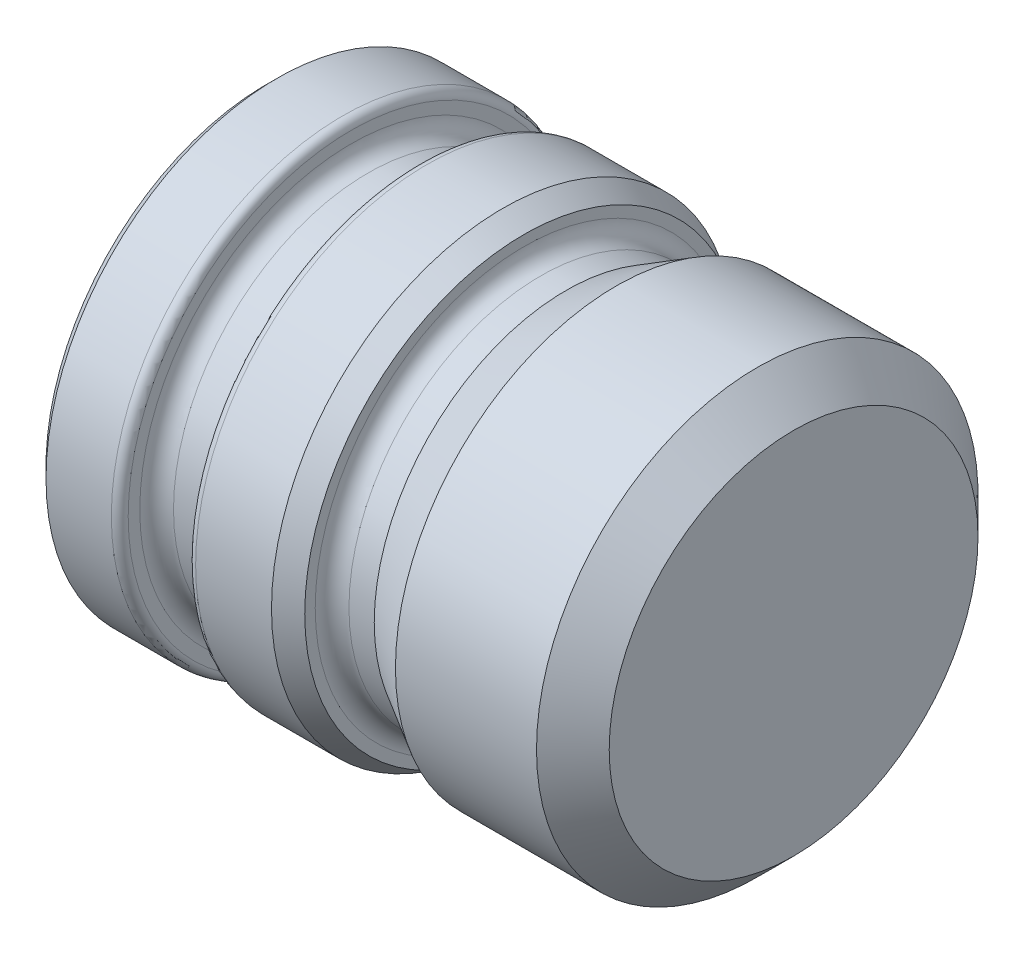
from build123d import *

# Parameters (mm, degrees)
SKETCH2_W          = 10
SKETCH2_H          = 10
CUT_EXTRUDE1_DEPTH = 10
CHAMFER2_SIZE      = 0.5
CHAMFER3_SIZE      = 1
CHAMFER3_SIZE2     = 0.577350269
SKETCH3_R          = 1.75
CUT_EXTRUDE2_DEPTH = 10
CHAMFER4_SIZE      = 0.5
CUT_EXTRUDE3_DEPTH = 0.01


with BuildPart() as part:
    # Sketch1 → Revolve1 (revolve)
    with BuildSketch(Plane.XY, mode=Mode.PRIVATE) as revolve1_sk:
        with BuildLine():
            Line((0, 0), (0, 8.75))
            Line((0, 8.75), (-1.725, 10.475))
            Line((-1.725, 10.475), (-8.41843014, 10.475))
            Line((-8.41843014, 10.475), (-10.8, 9.1))
            Line((-10.8, 9.1), (-12, 9.1))
            ThreePointArc((-12, 9.1), (-12.565685425, 9.334314575), (-12.8, 9.9))
            Line((-12.8, 9.9), (-12.8, 10.975))
            Line((-12.8, 10.975), (-17.4, 10.975))
            ThreePointArc((-17.4, 10.975), (-17.682842712, 10.857842712), (-17.8, 10.575))
            Line((-17.8, 10.575), (-17.8, 10.025))
            ThreePointArc((-17.8, 10.025), (-18.034314575, 9.459314575), (-18.6, 9.225))
            Line((-18.6, 9.225), (-20.2, 9.225))
            ThreePointArc((-20.2, 9.225), (-20.765685425, 9.459314575), (-21, 10.025))
            Line((-21, 10.025), (-21, 10.575))
            ThreePointArc((-21, 10.575), (-21.117157288, 10.857842712), (-21.4, 10.975))
            Line((-21.4, 10.975), (-25, 10.975))
            Line((-25, 10.975), (-25, 0))
            Line((-25, 0), (0, 0))
        make_face()
    revolve(revolve1_sk.sketch.rotate(Axis((0, 0, 0), (1, 0, 0)), 90), axis=Axis((0, 0, 0), (1, 0, 0)))

    # Sketch2 → Cut-Extrude1 (cut)
    with BuildSketch(Plane.ZY.offset(25)):
        Rectangle(SKETCH2_W, SKETCH2_H)
    extrude(amount=-CUT_EXTRUDE1_DEPTH, mode=Mode.SUBTRACT)

    # Chamfer2
    chamfer2_edges = [part.edges().sort_by_distance(p)[0] for p in [
        (-25, 0, -10.975),
    ]]
    chamfer(chamfer2_edges, length=CHAMFER2_SIZE)

    # Chamfer3
    chamfer3_edges = [part.edges().sort_by_distance(p)[0] for p in [
        (-12.8, 0, -10.975),
    ]]
    chamfer3_side = [part.faces().sort_by_distance(p)[0] for p in [
        (-15.1, 0, -10.975),
    ]]
    chamfer(chamfer3_edges, length=CHAMFER3_SIZE, length2=CHAMFER3_SIZE2, reference=chamfer3_side[0])

    # Sketch3 → Cut-Extrude2 (cut)
    with BuildSketch(Plane.ZY.offset(25)):
        with Locations((3.8, 3.8)):
            Circle(SKETCH3_R)
        with Locations((-3.8, 3.8)):
            Circle(SKETCH3_R)
        with Locations((3.8, -3.8)):
            Circle(SKETCH3_R)
        with Locations((-3.8, -3.8)):
            Circle(SKETCH3_R)
    extrude(amount=-CUT_EXTRUDE2_DEPTH, mode=Mode.SUBTRACT)

    # Chamfer4
    chamfer4_edges = [part.edges().sort_by_distance(p)[0] for p in [
        (-25, 5, 0),
        (-25, 5.037436867, 5.037436867),
        (-25, 0, -5),
        (-25, 5.037436867, -5.037436867),
        (-25, 0, 5),
        (-25, -5.037436867, 5.037436867),
        (-25, -5, 0),
        (-25, -5.037436867, -5.037436867),
    ]]
    chamfer(chamfer4_edges, length=CHAMFER4_SIZE)

    # Sketch4 → Cut-Extrude3 (cut)
    # profile 1 of 9: a face of its own
    with BuildSketch(Plane.ZY.offset(25)):
        Polygon((-4.989709676, -6.578354422), (-4.712365926, -6.578354422), (-4.712365926, -8.078354422), (-4.84698131, -8.078354422), (-4.84698131, -6.732200576), (-5.077750541, -6.732200576), align=None)
    # profile 2 of 9: a face of its own
    with BuildSketch(Plane.ZY.offset(25)):
        with BuildLine():
            Line((-3.212365926, -6.578354422), (-3.212365926, -6.732200576))
            Line((-3.212365926, -6.732200576), (-3.722582272, -6.732200576))
            Line((-3.722582272, -6.732200576), (-3.803411599, -7.126731826))
            add(Edge.make_bspline(
                [(-3.803411599, -7.126731826), (-3.78753051, -7.122347424), (-3.756763411, -7.113853338), (-3.711352042, -7.104422293), (-3.668241098, -7.098737103), (-3.640265939, -7.097960827), (-3.626728906, -7.097585191)],
                knots=[0, 0, 0, 0, 1.100273476, 2.13160584, 3.095893838, 4, 4, 4, 4], degree=3))
            add(Edge.make_bspline(
                [(-3.626728906, -7.097585191), (-3.609978732, -7.097947735), (-3.577043705, -7.098660587), (-3.528855585, -7.105505665), (-3.482855773, -7.116279914), (-3.439140472, -7.131331567), (-3.397628807, -7.150578595), (-3.358702709, -7.174621427), (-3.321777889, -7.20270714), (-3.287516778, -7.234997859), (-3.256434931, -7.270535695), (-3.22910665, -7.308746211), (-3.205894111, -7.349258066), (-3.187225217, -7.392458327), (-3.172317645, -7.437869393), (-3.162395361, -7.485969071), (-3.1557882, -7.53630398), (-3.155050035, -7.570720224), (-3.154673618, -7.588270287)],
                knots=[0, 0, 0, 0, 1.052922333, 2.070308379, 3.05430497, 4.020497103, 4.973039431, 5.925935799, 6.892292201, 7.88610001, 8.88166317, 9.857072816, 10.836096531, 11.812156883, 12.81219415, 13.836441305, 14.89672472, 16, 16, 16, 16], degree=3))
            add(Edge.make_bspline(
                [(-3.154673618, -7.588270287), (-3.15495865, -7.600494096), (-3.155524863, -7.624776519), (-3.158404257, -7.66083832), (-3.163948136, -7.696136677), (-3.171391446, -7.730676273), (-3.181052482, -7.764391718), (-3.192747791, -7.797379516), (-3.207060374, -7.829434347), (-3.222759535, -7.860859517), (-3.240436597, -7.890944591), (-3.260055957, -7.919079871), (-3.280784025, -7.94568742), (-3.303087476, -7.970481877), (-3.327173617, -7.993300314), (-3.352750745, -8.014278149), (-3.379614768, -8.033770147), (-3.4081813, -8.050985088), (-3.437813793, -8.066826355), (-3.468940172, -8.079822157), (-3.500851901, -8.091440955), (-3.534008276, -8.100702181), (-3.568334195, -8.10795899), (-3.603886242, -8.112887819), (-3.640477958, -8.11647772), (-3.665281535, -8.116702445), (-3.677810637, -8.11681596)],
                knots=[0, 0, 0, 0, 1.056347294, 2.098418968, 3.122841568, 4.141288669, 5.149314143, 6.15115421, 7.162517403, 8.180376062, 9.185164535, 10.17417709, 11.141909838, 12.097768115, 13.052685741, 14.0056014, 14.954263652, 15.917497458, 16.885230207, 17.854509472, 18.828990115, 19.81800267, 20.826176721, 21.857883937, 22.917946725, 24, 24, 24, 24], degree=3))
            add(Edge.make_bspline(
                [(-3.677810637, -8.11681596), (-3.692756715, -8.116519887), (-3.722161356, -8.115937398), (-3.765241599, -8.109843761), (-3.806690716, -8.101116368), (-3.846175045, -8.087986538), (-3.884048444, -8.071534841), (-3.919801037, -8.050742196), (-3.95434637, -8.027179723), (-3.9862801, -7.999373857), (-4.015918434, -7.968981422), (-4.042449795, -7.935999576), (-4.066078471, -7.900972672), (-4.086426077, -7.863730606), (-4.103782371, -7.824371235), (-4.117417366, -7.782747092), (-4.128422376, -7.739075662), (-4.133078127, -7.709009872), (-4.135442849, -7.693739037)],
                knots=[0, 0, 0, 0, 1.0467383, 2.05933395, 3.04377827, 4.011590433, 4.970194871, 5.932262533, 6.905835911, 7.896367577, 8.894135286, 9.877477877, 10.858688626, 11.851381753, 12.8477658, 13.868841284, 14.917554742, 16, 16, 16, 16], degree=3))
            Line((-4.135442849, -7.693739037), (-4.000827464, -7.693739037))
            add(Edge.make_bspline(
                [(-4.000827464, -7.693739037), (-3.997515225, -7.708043231), (-3.991148918, -7.735536686), (-3.977175026, -7.774164404), (-3.960089651, -7.808586928), (-3.939773501, -7.839259607), (-3.915537774, -7.86600632), (-3.887882304, -7.889842204), (-3.856876137, -7.911345831), (-3.822421896, -7.929269874), (-3.786073433, -7.944556482), (-3.748030343, -7.95473578), (-3.709328481, -7.961893306), (-3.683152036, -7.962609774), (-3.669998137, -7.962969807)],
                knots=[0, 0, 0, 0, 1.136247022, 2.183929868, 3.172523383, 4.106158343, 5.02341133, 5.958108904, 6.928429099, 7.938127109, 8.96079061, 9.975095812, 10.982467395, 12, 12, 12, 12], degree=3))
            add(Edge.make_bspline(
                [(-3.669998137, -7.962969807), (-3.657158804, -7.962618045), (-3.631878051, -7.961925422), (-3.594673171, -7.956594417), (-3.558753368, -7.94838403), (-3.524473072, -7.936096949), (-3.491232413, -7.921163498), (-3.459872225, -7.901999894), (-3.429485278, -7.879945601), (-3.401016078, -7.854678473), (-3.374942028, -7.826834319), (-3.35190369, -7.797058293), (-3.332713585, -7.76529393), (-3.316541824, -7.73209115), (-3.304261839, -7.697086054), (-3.295501418, -7.660442693), (-3.29035725, -7.622070559), (-3.289649601, -7.595897998), (-3.289289002, -7.582561153)],
                knots=[0, 0, 0, 0, 1.027316725, 2.022795036, 3.002884548, 3.971462791, 4.93288096, 5.914575861, 6.907176829, 7.935150275, 8.956128384, 9.956726525, 10.942570165, 11.921478529, 12.907843606, 13.90538589, 14.932640048, 16, 16, 16, 16], degree=3))
            add(Edge.make_bspline(
                [(-3.289289002, -7.582561153), (-3.289571208, -7.570528688), (-3.290123585, -7.54697685), (-3.294636687, -7.512520047), (-3.302486818, -7.479917314), (-3.313382766, -7.449011214), (-3.327216841, -7.419772596), (-3.344122403, -7.392171284), (-3.364416717, -7.36657107), (-3.387598955, -7.342959976), (-3.412995258, -7.321169315), (-3.441042576, -7.302593278), (-3.471153973, -7.286965885), (-3.502966659, -7.2734796), (-3.53723733, -7.263793566), (-3.573287315, -7.256521615), (-3.611505904, -7.252315031), (-3.637636199, -7.251731365), (-3.651067849, -7.251431345)],
                knots=[0, 0, 0, 0, 1.045622112, 2.046656509, 3.013763289, 3.955457236, 4.890082067, 5.820317437, 6.762574623, 7.722996705, 8.69280354, 9.665887285, 10.63943826, 11.638615906, 12.663482002, 13.728887084, 14.832589034, 16, 16, 16, 16], degree=3))
            add(Edge.make_bspline(
                [(-3.651067849, -7.251431345), (-3.662694532, -7.25168017), (-3.686700685, -7.25219393), (-3.723524753, -7.255976714), (-3.762221206, -7.262079269), (-3.802641704, -7.270473375), (-3.844907636, -7.281458122), (-3.888929808, -7.29462148), (-3.934800779, -7.310359479), (-3.965708375, -7.322244714), (-3.981596695, -7.328354422)],
                knots=[0, 0, 0, 0, 0.817624296, 1.688186739, 2.600797293, 3.572016777, 4.590301741, 5.671205678, 6.80286297, 8, 8, 8, 8], degree=3))
            Line((-3.981596695, -7.328354422), (-3.827750541, -6.578354422))
            Line((-3.827750541, -6.578354422), (-3.212365926, -6.578354422))
        make_face()
    # profile 3 of 9: a face of its own
    with BuildSketch(Plane.ZY.offset(25)):
        with BuildLine():
            add(Edge.make_bspline(
                [(-3.000827464, -7.328955383), (-3.000686885, -7.304913646), (-3.000413808, -7.258212224), (-2.997375913, -7.190161663), (-2.992329338, -7.126321539), (-2.985413321, -7.066688797), (-2.976997043, -7.011248041), (-2.965761835, -6.96014743), (-2.95298492, -6.913150456), (-2.938176728, -6.870103864), (-2.921467676, -6.830427705), (-2.903281564, -6.793388333), (-2.882896652, -6.759041791), (-2.861477975, -6.726839881), (-2.838158516, -6.697309726), (-2.813601892, -6.670034299), (-2.786849659, -6.645643977), (-2.758811227, -6.623424134), (-2.729232742, -6.603945789), (-2.698957314, -6.586788901), (-2.667776554, -6.572131815), (-2.635605333, -6.560607342), (-2.602732808, -6.551088408), (-2.569044065, -6.544578859), (-2.534483481, -6.540483041), (-2.511155723, -6.540091469), (-2.49932506, -6.539892883)],
                knots=[0, 0, 0, 0, 1.646270934, 3.197905019, 4.663502075, 6.030701355, 7.308322542, 8.50163776, 9.611534131, 10.641858119, 11.616356847, 12.558055219, 13.465016945, 14.349605745, 15.204443733, 16.039544428, 16.859896111, 17.680448484, 18.487036065, 19.28249412, 20.06191084, 20.843045899, 21.620316918, 22.403196591, 23.190181807, 24, 24, 24, 24], degree=3))
            add(Edge.make_bspline(
                [(-2.49932506, -6.539892883), (-2.487395569, -6.540101947), (-2.463671566, -6.540517709), (-2.428597119, -6.544513684), (-2.39433297, -6.551144166), (-2.361025196, -6.560538869), (-2.328400202, -6.572194159), (-2.29671317, -6.586802924), (-2.265767278, -6.603808152), (-2.236054297, -6.623789814), (-2.207248034, -6.646067932), (-2.18005605, -6.671251933), (-2.15447587, -6.699087527), (-2.130186453, -6.729276898), (-2.107876912, -6.762399077), (-2.086631155, -6.797877981), (-2.067614568, -6.836334066), (-2.049299707, -6.877125695), (-2.033490999, -6.921381549), (-2.019234037, -6.96885216), (-2.007714479, -7.02009824), (-1.998119076, -7.074850917), (-1.990685549, -7.133311267), (-1.98527156, -7.195353974), (-1.982411666, -7.261019855), (-1.98187308, -7.305916076), (-1.981596695, -7.328955383)],
                knots=[0, 0, 0, 0, 0.810914788, 1.612654377, 2.396697861, 3.181598691, 3.963628158, 4.749916497, 5.551656086, 6.361998678, 7.18212741, 8.025565596, 8.878627764, 9.750805457, 10.657531673, 11.591944965, 12.560506719, 13.57287815, 14.630710178, 15.753379473, 16.941251878, 18.199788006, 19.531962791, 20.947069417, 22.433333509, 24, 24, 24, 24], degree=3))
            add(Edge.make_bspline(
                [(-1.981596695, -7.328955383), (-1.981875945, -7.351894201), (-1.982420054, -7.396589552), (-1.985239499, -7.46195997), (-1.990793198, -7.523673417), (-1.997740336, -7.581877901), (-2.007362177, -7.636331166), (-2.019192963, -7.687221644), (-2.032328816, -7.734769103), (-2.048543727, -7.778584023), (-2.066291175, -7.819277618), (-2.085600544, -7.857277825), (-2.106287613, -7.892920521), (-2.128825646, -7.925920413), (-2.152848538, -7.956511266), (-2.178870447, -7.984153104), (-2.206157841, -8.009511964), (-2.235048876, -8.032076947), (-2.265225255, -8.051827578), (-2.29606486, -8.069490656), (-2.328114881, -8.08373324), (-2.360649004, -8.095962543), (-2.394132589, -8.105305594), (-2.4285239, -8.111765818), (-2.463648001, -8.11629661), (-2.487391529, -8.116642244), (-2.49932506, -8.11681596)],
                knots=[0, 0, 0, 0, 1.561518951, 3.042555995, 4.452378317, 5.7783523, 7.031515105, 8.214008947, 9.334062868, 10.386615937, 11.391082383, 12.354592575, 13.286541444, 14.194233754, 15.072674879, 15.931287219, 16.775624067, 17.606195743, 18.42308326, 19.229000347, 20.022332153, 20.807536673, 21.593273796, 22.3848459, 23.188221202, 24, 24, 24, 24], degree=3))
            add(Edge.make_bspline(
                [(-2.49932506, -8.11681596), (-2.511155395, -8.116616094), (-2.534482505, -8.116221996), (-2.569047831, -8.112144682), (-2.602597449, -8.105589467), (-2.635296915, -8.096410922), (-2.667313993, -8.085175992), (-2.698212402, -8.070538699), (-2.728335695, -8.053681241), (-2.757603504, -8.034483203), (-2.785465859, -8.012488196), (-2.812079547, -7.988160644), (-2.836775984, -7.960893468), (-2.859762025, -7.931117215), (-2.881608063, -7.899105825), (-2.901703508, -7.864422237), (-2.920291017, -7.827203975), (-2.937281085, -7.787210585), (-2.952344798, -7.743858473), (-2.965650958, -7.696651682), (-2.976157026, -7.645173553), (-2.985149721, -7.589837538), (-2.992403028, -7.530405854), (-2.997354882, -7.466846234), (-3.000415445, -7.399198288), (-3.000687618, -7.352796956), (-3.000827464, -7.328955383)],
                knots=[0, 0, 0, 0, 0.810891512, 1.598919785, 2.382837074, 3.152667961, 3.926044502, 4.706494248, 5.493654104, 6.291793342, 7.103789334, 7.925228297, 8.761435821, 9.622817696, 10.50288917, 11.416980706, 12.369136599, 13.353924996, 14.394355917, 15.514179734, 16.714354668, 17.994756427, 19.357759367, 20.818452758, 22.365282078, 24, 24, 24, 24], degree=3))
        make_face()
        with BuildLine():
            add(Edge.make_bspline(
                [(-2.866212079, -7.328354422), (-2.866160888, -7.348389579), (-2.866061535, -7.387273883), (-2.86346602, -7.443778138), (-2.859930207, -7.496479708), (-2.855369651, -7.545445509), (-2.848596959, -7.5905098), (-2.841008335, -7.631982521), (-2.83177344, -7.669644194), (-2.820847003, -7.703753256), (-2.808401676, -7.734888571), (-2.794813449, -7.763860521), (-2.780215996, -7.791011351), (-2.763879217, -7.816097183), (-2.746087047, -7.839199824), (-2.727241365, -7.860728181), (-2.706638829, -7.879926887), (-2.678137225, -7.902952682), (-2.640510164, -7.926746597), (-2.593101398, -7.94746635), (-2.544386347, -7.960487402), (-2.511321526, -7.962143298), (-2.494817849, -7.962969807)],
                knots=[0, 0, 0, 0, 1.459021318, 2.831673884, 4.118529203, 5.306027144, 6.411944654, 7.436330062, 8.375795394, 9.233974572, 10.042671642, 10.816086306, 11.563610507, 12.285937304, 12.993564865, 13.685989202, 14.367179055, 15.041617293, 16.353048772, 17.594441528, 18.799311195, 20, 20, 20, 20], degree=3))
            add(Edge.make_bspline(
                [(-2.494817849, -7.962969807), (-2.478207418, -7.962285043), (-2.445020851, -7.960916931), (-2.396534939, -7.947717472), (-2.349464823, -7.927801955), (-2.312576848, -7.904253024), (-2.284512901, -7.881826597), (-2.26440562, -7.862706034), (-2.245950456, -7.841296376), (-2.22844671, -7.818196678), (-2.21239282, -7.792965613), (-2.197794333, -7.76572451), (-2.184472898, -7.736397719), (-2.176883307, -7.715924974), (-2.173002945, -7.705457787)],
                knots=[0, 0, 0, 0, 1.353760809, 2.704726607, 4.075137775, 5.516104923, 6.260822281, 7.007110065, 7.778089737, 8.566572457, 9.372053459, 10.217411131, 11.088608312, 12, 12, 12, 12], degree=3))
            add(Edge.make_bspline(
                [(-2.173002945, -7.705457787), (-2.168480759, -7.692073613), (-2.159298781, -7.664898), (-2.147465164, -7.622742149), (-2.138145707, -7.578512393), (-2.129761407, -7.532473057), (-2.124038669, -7.484284614), (-2.119432463, -7.434096164), (-2.116719312, -7.381869866), (-2.11638299, -7.346386298), (-2.116212079, -7.328354422)],
                knots=[0, 0, 0, 0, 0.884706709, 1.796334032, 2.740027952, 3.714592787, 4.726048262, 5.777819803, 6.87074269, 8, 8, 8, 8], degree=3))
            add(Edge.make_bspline(
                [(-2.116212079, -7.328354422), (-2.116447875, -7.310325462), (-2.116909141, -7.275056963), (-2.118672279, -7.223406314), (-2.123225239, -7.174348702), (-2.128282004, -7.127672786), (-2.135737956, -7.083636942), (-2.143777016, -7.041872525), (-2.154577536, -7.002896943), (-2.166114582, -6.966099979), (-2.179319037, -6.931899699), (-2.193854352, -6.900136648), (-2.209377963, -6.87065748), (-2.226238923, -6.843543076), (-2.244237073, -6.818671986), (-2.263847451, -6.796542875), (-2.284292183, -6.776469888), (-2.312928119, -6.753557359), (-2.350417101, -6.730195203), (-2.397065235, -6.708695592), (-2.445609797, -6.696349181), (-2.478426992, -6.694608458), (-2.494817849, -6.693739037)],
                knots=[0, 0, 0, 0, 1.31362396, 2.569729283, 3.763502607, 4.902122613, 5.988968491, 7.01645872, 7.998833611, 8.933434873, 9.825090667, 10.667526885, 11.477055099, 12.250526234, 12.991942729, 13.710640831, 14.402115721, 15.076753259, 16.378508321, 17.609869233, 18.806226677, 20, 20, 20, 20], degree=3))
            add(Edge.make_bspline(
                [(-2.494817849, -6.693739037), (-2.511408102, -6.694609657), (-2.544618833, -6.696352483), (-2.593667957, -6.708649592), (-2.640684107, -6.73008372), (-2.678073954, -6.753634737), (-2.706729862, -6.776065442), (-2.726908159, -6.795516779), (-2.745827948, -6.816793746), (-2.763256962, -6.840108852), (-2.77958094, -6.865165438), (-2.794572803, -6.892160623), (-2.80808023, -6.921231208), (-2.820545031, -6.952352537), (-2.831504797, -6.986458656), (-2.840545067, -7.024073939), (-2.848896662, -7.06541475), (-2.85480892, -7.11072311), (-2.860064815, -7.159701176), (-2.863442536, -7.212534312), (-2.866070217, -7.269133333), (-2.866163845, -7.308218686), (-2.866212079, -7.328354422)],
                knots=[0, 0, 0, 0, 1.207732386, 2.417664972, 3.655092373, 4.956220595, 5.625982001, 6.301752483, 6.994047911, 7.697131622, 8.419323945, 9.170223765, 9.943494443, 10.752040957, 11.610060368, 12.549350801, 13.567764191, 14.679664412, 15.874934091, 17.154273443, 18.533957287, 20, 20, 20, 20], degree=3))
        make_face(mode=Mode.SUBTRACT)
    # profile 4 of 9: a face of its own
    with BuildSketch(Plane.ZY.offset(25)):
        with BuildLine():
            Line((-1.077750541, -7.039892883), (-1.212365926, -7.039892883))
            add(Edge.make_bspline(
                [(-1.212365926, -7.039892883), (-1.211488574, -7.022033932), (-1.20976548, -6.986959425), (-1.201696213, -6.935820608), (-1.190150123, -6.88693998), (-1.173825214, -6.840710017), (-1.153551095, -6.796721957), (-1.129238226, -6.755150522), (-1.100440861, -6.716154298), (-1.067780832, -6.680094794), (-1.032308559, -6.647014406), (-0.994034584, -6.618447873), (-0.953815287, -6.594311729), (-0.911772688, -6.574134054), (-0.867432446, -6.558988405), (-0.821196935, -6.54775056), (-0.77286302, -6.540989269), (-0.739931582, -6.540262503), (-0.723183233, -6.539892883)],
                knots=[0, 0, 0, 0, 1.10065271, 2.161652631, 3.183658789, 4.190468796, 5.17591951, 6.163126047, 7.15150782, 8.156236427, 9.156009102, 10.134482811, 11.092018607, 12.041330605, 13.001268258, 13.972401359, 14.968799086, 16, 16, 16, 16], degree=3))
            add(Edge.make_bspline(
                [(-0.723183233, -6.539892883), (-0.706735487, -6.540277936), (-0.674416254, -6.541034551), (-0.627246819, -6.547532135), (-0.582342264, -6.557708817), (-0.539790364, -6.571986853), (-0.499930622, -6.591180179), (-0.462463603, -6.614236267), (-0.426943256, -6.640901909), (-0.39496892, -6.6722964), (-0.365608315, -6.705811708), (-0.340278777, -6.741592238), (-0.318587421, -6.778547646), (-0.300506987, -6.816959733), (-0.287197213, -6.857190173), (-0.277092266, -6.89865326), (-0.271380518, -6.941778179), (-0.270503908, -6.970966703), (-0.270058233, -6.985806345)],
                knots=[0, 0, 0, 0, 1.111607364, 2.184268762, 3.212621178, 4.221274766, 5.211760367, 6.196651075, 7.1921475, 8.207485113, 9.220403448, 10.201281604, 11.166441695, 12.114753415, 13.065576456, 14.026450734, 14.996634279, 16, 16, 16, 16], degree=3))
            add(Edge.make_bspline(
                [(-0.270058233, -6.985806345), (-0.270783917, -7.006698274), (-0.272222551, -7.048115509), (-0.284528712, -7.108979021), (-0.303748645, -7.167947629), (-0.32689037, -7.215406473), (-0.350235703, -7.253649399), (-0.371273206, -7.285135987), (-0.395900982, -7.31903833), (-0.424477482, -7.355242904), (-0.45641157, -7.394033291), (-0.491992497, -7.435386061), (-0.531473989, -7.478873962), (-0.559184775, -7.508576363), (-0.57354381, -7.523967403)],
                knots=[0, 0, 0, 0, 1.184426356, 2.348067706, 3.509069118, 4.696110526, 5.333549288, 6.050745305, 6.844228056, 7.710549037, 8.667450064, 9.695053472, 10.805634456, 12, 12, 12, 12], degree=3))
            Line((-0.57354381, -7.523967403), (-0.948844291, -7.924508268))
            Line((-0.948844291, -7.924508268), (-0.250827464, -7.924508268))
            Line((-0.250827464, -7.924508268), (-0.250827464, -8.078354422))
            Line((-0.250827464, -8.078354422), (-1.270058233, -8.078354422))
            Line((-1.270058233, -8.078354422), (-0.688327464, -7.457561153))
            add(Edge.make_bspline(
                [(-0.688327464, -7.457561153), (-0.674164084, -7.442776164), (-0.646959129, -7.414377227), (-0.608480882, -7.372915958), (-0.573921316, -7.33445187), (-0.543056719, -7.299057635), (-0.516556645, -7.266215534), (-0.493039974, -7.236989232), (-0.474197578, -7.210094468), (-0.453748123, -7.178919919), (-0.433942131, -7.140857498), (-0.41692255, -7.094343059), (-0.406544758, -7.046459951), (-0.405299828, -7.014101935), (-0.404673618, -6.997825576)],
                knots=[0, 0, 0, 0, 1.329631726, 2.553950428, 3.673215718, 4.687767853, 5.603093632, 6.413772471, 7.123043292, 7.734684054, 8.834405432, 9.900288307, 10.943827018, 12, 12, 12, 12], degree=3))
            add(Edge.make_bspline(
                [(-0.404673618, -6.997825576), (-0.404946079, -6.987590691), (-0.405483047, -6.967419698), (-0.41022206, -6.937845801), (-0.417383706, -6.909318024), (-0.427645959, -6.881748615), (-0.441191705, -6.855414765), (-0.457680296, -6.830284416), (-0.476704609, -6.805989145), (-0.498712296, -6.78320916), (-0.522888662, -6.762345786), (-0.548429054, -6.743864036), (-0.575450528, -6.728418702), (-0.603839151, -6.715757204), (-0.633515781, -6.705824897), (-0.664537815, -6.698942649), (-0.696819536, -6.694621584), (-0.718862463, -6.694036939), (-0.730094291, -6.693739037)],
                knots=[0, 0, 0, 0, 0.991446411, 1.95395049, 2.89581595, 3.838931463, 4.798493298, 5.75982156, 6.748411868, 7.785213223, 8.824556874, 9.840280684, 10.836137867, 11.835679398, 12.848801643, 13.863922112, 14.911575587, 16, 16, 16, 16], degree=3))
            add(Edge.make_bspline(
                [(-0.730094291, -6.693739037), (-0.741824648, -6.69404548), (-0.764861132, -6.694647282), (-0.798683575, -6.698856995), (-0.830948908, -6.706119498), (-0.861738295, -6.716052359), (-0.891103832, -6.728677451), (-0.918902708, -6.744402484), (-0.945072517, -6.763166839), (-0.969662456, -6.784441363), (-0.992318447, -6.808127478), (-1.012224251, -6.834531747), (-1.0296174, -6.863172068), (-1.044792786, -6.893971161), (-1.057116653, -6.927208496), (-1.066533717, -6.962766083), (-1.073985223, -7.000489533), (-1.076474589, -7.026540283), (-1.077750541, -7.039892883)],
                knots=[0, 0, 0, 0, 1.031018746, 2.02475058, 2.990194455, 3.934040569, 4.864654155, 5.795059489, 6.735614925, 7.690564532, 8.649604399, 9.611025574, 10.590972636, 11.591080095, 12.624614302, 13.701020113, 14.821632451, 16, 16, 16, 16], degree=3))
        make_face()
    # profile 5 of 9: a face of its own
    with BuildSketch(Plane.ZY.offset(25)):
        with BuildLine():
            Line((0.076095613, -7.039892883), (-0.058519772, -7.039892883))
            add(Edge.make_bspline(
                [(-0.058519772, -7.039892883), (-0.05764242, -7.022033932), (-0.055919326, -6.986959425), (-0.047850059, -6.935820608), (-0.036303969, -6.88693998), (-0.01997906, -6.840710017), (0.000295059, -6.796721957), (0.024607928, -6.755150522), (0.053405293, -6.716154298), (0.086065321, -6.680094794), (0.121537595, -6.647014406), (0.159811569, -6.618447873), (0.200030867, -6.594311729), (0.242073466, -6.574134054), (0.286413708, -6.558988405), (0.332649218, -6.54775056), (0.380983134, -6.540989269), (0.413914572, -6.540262503), (0.430662921, -6.539892883)],
                knots=[0, 0, 0, 0, 1.10065271, 2.161652631, 3.183658789, 4.190468796, 5.17591951, 6.163126047, 7.15150782, 8.156236427, 9.156009102, 10.134482811, 11.092018607, 12.041330605, 13.001268258, 13.972401359, 14.968799086, 16, 16, 16, 16], degree=3))
            add(Edge.make_bspline(
                [(0.430662921, -6.539892883), (0.447110667, -6.540277936), (0.4794299, -6.541034551), (0.526599335, -6.547532135), (0.57150389, -6.557708817), (0.61405579, -6.571986853), (0.653915532, -6.591180179), (0.691382551, -6.614236267), (0.726902898, -6.640901909), (0.758877234, -6.6722964), (0.788237839, -6.705811708), (0.813567377, -6.741592238), (0.835258733, -6.778547646), (0.853339167, -6.816959733), (0.866648941, -6.857190173), (0.876753887, -6.89865326), (0.882465636, -6.941778179), (0.883342246, -6.970966703), (0.883787921, -6.985806345)],
                knots=[0, 0, 0, 0, 1.111607364, 2.184268762, 3.212621178, 4.221274766, 5.211760367, 6.196651075, 7.1921475, 8.207485113, 9.220403448, 10.201281604, 11.166441695, 12.114753415, 13.065576456, 14.026450734, 14.996634279, 16, 16, 16, 16], degree=3))
            add(Edge.make_bspline(
                [(0.883787921, -6.985806345), (0.883062237, -7.006698274), (0.881623603, -7.048115509), (0.869317442, -7.108979021), (0.850097508, -7.167947629), (0.826955784, -7.215406473), (0.803610451, -7.253649399), (0.782572948, -7.285135987), (0.757945171, -7.31903833), (0.729368672, -7.355242904), (0.697434584, -7.394033291), (0.661853657, -7.435386061), (0.622372165, -7.478873962), (0.594661379, -7.508576363), (0.580302344, -7.523967403)],
                knots=[0, 0, 0, 0, 1.184426356, 2.348067706, 3.509069118, 4.696110526, 5.333549288, 6.050745305, 6.844228056, 7.710549037, 8.667450064, 9.695053472, 10.805634456, 12, 12, 12, 12], degree=3))
            Line((0.580302344, -7.523967403), (0.205001863, -7.924508268))
            Line((0.205001863, -7.924508268), (0.90301869, -7.924508268))
            Line((0.90301869, -7.924508268), (0.90301869, -8.078354422))
            Line((0.90301869, -8.078354422), (-0.116212079, -8.078354422))
            Line((-0.116212079, -8.078354422), (0.46551869, -7.457561153))
            add(Edge.make_bspline(
                [(0.46551869, -7.457561153), (0.47968207, -7.442776164), (0.506887024, -7.414377227), (0.545365272, -7.372915958), (0.579924838, -7.33445187), (0.610789435, -7.299057635), (0.637289509, -7.266215534), (0.660806179, -7.236989232), (0.679648576, -7.210094468), (0.700098031, -7.178919919), (0.719904023, -7.140857498), (0.736923604, -7.094343059), (0.747301396, -7.046459951), (0.748546326, -7.014101935), (0.749172536, -6.997825576)],
                knots=[0, 0, 0, 0, 1.329631726, 2.553950428, 3.673215718, 4.687767853, 5.603093632, 6.413772471, 7.123043292, 7.734684054, 8.834405432, 9.900288307, 10.943827018, 12, 12, 12, 12], degree=3))
            add(Edge.make_bspline(
                [(0.749172536, -6.997825576), (0.748900075, -6.987590691), (0.748363107, -6.967419698), (0.743624094, -6.937845801), (0.736462448, -6.909318024), (0.726200195, -6.881748615), (0.712654449, -6.855414765), (0.696165857, -6.830284416), (0.677141545, -6.805989145), (0.655133858, -6.78320916), (0.630957492, -6.762345786), (0.605417099, -6.743864036), (0.578395626, -6.728418702), (0.550007002, -6.715757204), (0.520330373, -6.705824897), (0.489308339, -6.698942649), (0.457026618, -6.694621584), (0.434983691, -6.694036939), (0.423751863, -6.693739037)],
                knots=[0, 0, 0, 0, 0.991446411, 1.95395049, 2.89581595, 3.838931463, 4.798493298, 5.75982156, 6.748411868, 7.785213223, 8.824556874, 9.840280684, 10.836137867, 11.835679398, 12.848801643, 13.863922112, 14.911575587, 16, 16, 16, 16], degree=3))
            add(Edge.make_bspline(
                [(0.423751863, -6.693739037), (0.412021506, -6.69404548), (0.388985022, -6.694647282), (0.355162579, -6.698856995), (0.322897246, -6.706119498), (0.292107859, -6.716052359), (0.262742322, -6.728677451), (0.234943446, -6.744402484), (0.208773637, -6.763166839), (0.184183698, -6.784441363), (0.161527707, -6.808127478), (0.141621903, -6.834531747), (0.124228754, -6.863172068), (0.109053368, -6.893971161), (0.096729501, -6.927208496), (0.087312437, -6.962766083), (0.079860931, -7.000489533), (0.077371565, -7.026540283), (0.076095613, -7.039892883)],
                knots=[0, 0, 0, 0, 1.031018746, 2.02475058, 2.990194455, 3.934040569, 4.864654155, 5.795059489, 6.735614925, 7.690564532, 8.649604399, 9.611025574, 10.590972636, 11.591080095, 12.624614302, 13.701020113, 14.821632451, 16, 16, 16, 16], degree=3))
        make_face()
    # profile 6 of 9: a face of its own
    with BuildSketch(Plane.ZY.offset(25)):
        Polygon((1.356444171, -6.578354422), (1.633787921, -6.578354422), (1.633787921, -8.078354422), (1.499172536, -8.078354422), (1.499172536, -6.732200576), (1.268403305, -6.732200576), align=None)
    # profile 7 of 9: a face of its own
    with BuildSketch(Plane.ZY.offset(25)):
        with BuildLine():
            Line((3.710710998, -6.578354422), (3.710710998, -6.732200576))
            Line((3.710710998, -6.732200576), (3.200494651, -6.732200576))
            Line((3.200494651, -6.732200576), (3.119665324, -7.126731826))
            add(Edge.make_bspline(
                [(3.119665324, -7.126731826), (3.135546413, -7.122347424), (3.166313512, -7.113853338), (3.211724881, -7.104422293), (3.254835825, -7.098737103), (3.282810984, -7.097960827), (3.296348017, -7.097585191)],
                knots=[0, 0, 0, 0, 1.100273476, 2.13160584, 3.095893838, 4, 4, 4, 4], degree=3))
            add(Edge.make_bspline(
                [(3.296348017, -7.097585191), (3.313098191, -7.097947735), (3.346033218, -7.098660587), (3.394221339, -7.105505665), (3.44022115, -7.116279914), (3.483936451, -7.131331567), (3.525448116, -7.150578595), (3.564374214, -7.174621427), (3.601299034, -7.20270714), (3.635560145, -7.234997859), (3.666641992, -7.270535695), (3.693970273, -7.308746211), (3.717182812, -7.349258066), (3.735851707, -7.392458327), (3.750759278, -7.437869393), (3.760681562, -7.485969071), (3.767288723, -7.53630398), (3.768026888, -7.570720224), (3.768403305, -7.588270287)],
                knots=[0, 0, 0, 0, 1.052922333, 2.070308379, 3.05430497, 4.020497103, 4.973039431, 5.925935799, 6.892292201, 7.88610001, 8.88166317, 9.857072816, 10.836096531, 11.812156883, 12.81219415, 13.836441305, 14.89672472, 16, 16, 16, 16], degree=3))
            add(Edge.make_bspline(
                [(3.768403305, -7.588270287), (3.768118273, -7.600494096), (3.76755206, -7.624776519), (3.764672666, -7.66083832), (3.759128787, -7.696136677), (3.751685477, -7.730676273), (3.742024441, -7.764391718), (3.730329132, -7.797379516), (3.716016549, -7.829434347), (3.700317388, -7.860859517), (3.682640326, -7.890944591), (3.663020966, -7.919079871), (3.642292898, -7.94568742), (3.619989447, -7.970481877), (3.595903306, -7.993300314), (3.570326178, -8.014278149), (3.543462155, -8.033770147), (3.514895623, -8.050985088), (3.48526313, -8.066826355), (3.454136751, -8.079822157), (3.422225023, -8.091440955), (3.389068647, -8.100702181), (3.354742728, -8.10795899), (3.319190681, -8.112887819), (3.282598965, -8.11647772), (3.257795388, -8.116702445), (3.245266286, -8.11681596)],
                knots=[0, 0, 0, 0, 1.056347294, 2.098418968, 3.122841568, 4.141288669, 5.149314143, 6.15115421, 7.162517403, 8.180376062, 9.185164535, 10.17417709, 11.141909838, 12.097768115, 13.052685741, 14.0056014, 14.954263652, 15.917497458, 16.885230207, 17.854509472, 18.828990115, 19.81800267, 20.826176721, 21.857883937, 22.917946725, 24, 24, 24, 24], degree=3))
            add(Edge.make_bspline(
                [(3.245266286, -8.11681596), (3.230320209, -8.116519887), (3.200915567, -8.115937398), (3.157835324, -8.109843761), (3.116386207, -8.101116368), (3.076901878, -8.087986538), (3.039028479, -8.071534841), (3.003275886, -8.050742196), (2.968730553, -8.027179723), (2.936796823, -7.999373857), (2.907158489, -7.968981422), (2.880627128, -7.935999576), (2.856998452, -7.900972672), (2.836650846, -7.863730606), (2.819294552, -7.824371235), (2.805659557, -7.782747092), (2.794654547, -7.739075662), (2.789998796, -7.709009872), (2.787634074, -7.693739037)],
                knots=[0, 0, 0, 0, 1.0467383, 2.05933395, 3.04377827, 4.011590433, 4.970194871, 5.932262533, 6.905835911, 7.896367577, 8.894135286, 9.877477877, 10.858688626, 11.851381753, 12.8477658, 13.868841284, 14.917554742, 16, 16, 16, 16], degree=3))
            Line((2.787634074, -7.693739037), (2.922249459, -7.693739037))
            add(Edge.make_bspline(
                [(2.922249459, -7.693739037), (2.925561698, -7.708043231), (2.931928005, -7.735536686), (2.945901897, -7.774164404), (2.962987273, -7.808586928), (2.983303422, -7.839259607), (3.007539149, -7.86600632), (3.035194619, -7.889842204), (3.066200786, -7.911345831), (3.100655027, -7.929269874), (3.13700349, -7.944556482), (3.17504658, -7.95473578), (3.213748442, -7.961893306), (3.239924887, -7.962609774), (3.253078786, -7.962969807)],
                knots=[0, 0, 0, 0, 1.136247022, 2.183929868, 3.172523383, 4.106158343, 5.02341133, 5.958108904, 6.928429099, 7.938127109, 8.96079061, 9.975095812, 10.982467395, 12, 12, 12, 12], degree=3))
            add(Edge.make_bspline(
                [(3.253078786, -7.962969807), (3.265918119, -7.962618045), (3.291198872, -7.961925422), (3.328403752, -7.956594417), (3.364323555, -7.94838403), (3.398603851, -7.936096949), (3.431844511, -7.921163498), (3.463204698, -7.901999894), (3.493591645, -7.879945601), (3.522060845, -7.854678473), (3.548134895, -7.826834319), (3.571173233, -7.797058293), (3.590363338, -7.76529393), (3.606535099, -7.73209115), (3.618815084, -7.697086054), (3.627575505, -7.660442693), (3.632719673, -7.622070559), (3.633427322, -7.595897998), (3.633787921, -7.582561153)],
                knots=[0, 0, 0, 0, 1.027316725, 2.022795036, 3.002884548, 3.971462791, 4.93288096, 5.914575861, 6.907176829, 7.935150275, 8.956128384, 9.956726525, 10.942570165, 11.921478529, 12.907843606, 13.90538589, 14.932640048, 16, 16, 16, 16], degree=3))
            add(Edge.make_bspline(
                [(3.633787921, -7.582561153), (3.633505715, -7.570528688), (3.632953338, -7.54697685), (3.628440237, -7.512520047), (3.620590106, -7.479917314), (3.609694157, -7.449011214), (3.595860082, -7.419772596), (3.57895452, -7.392171284), (3.558660206, -7.36657107), (3.535477968, -7.342959976), (3.510081665, -7.321169315), (3.482034347, -7.302593278), (3.45192295, -7.286965885), (3.420110264, -7.2734796), (3.385839593, -7.263793566), (3.349789608, -7.256521615), (3.311571019, -7.252315031), (3.285440724, -7.251731365), (3.272009074, -7.251431345)],
                knots=[0, 0, 0, 0, 1.045622112, 2.046656509, 3.013763289, 3.955457236, 4.890082067, 5.820317437, 6.762574623, 7.722996705, 8.69280354, 9.665887285, 10.63943826, 11.638615906, 12.663482002, 13.728887084, 14.832589034, 16, 16, 16, 16], degree=3))
            add(Edge.make_bspline(
                [(3.272009074, -7.251431345), (3.260382391, -7.25168017), (3.236376238, -7.25219393), (3.19955217, -7.255976714), (3.160855717, -7.262079269), (3.120435219, -7.270473375), (3.078169287, -7.281458122), (3.034147115, -7.29462148), (2.988276144, -7.310359479), (2.957368548, -7.322244714), (2.941480228, -7.328354422)],
                knots=[0, 0, 0, 0, 0.817624296, 1.688186739, 2.600797293, 3.572016777, 4.590301741, 5.671205678, 6.80286297, 8, 8, 8, 8], degree=3))
            Line((2.941480228, -7.328354422), (3.095326382, -6.578354422))
            Line((3.095326382, -6.578354422), (3.710710998, -6.578354422))
        make_face()
    # profile 8 of 9: a face of its own
    with BuildSketch(Plane.ZY.offset(25)):
        with BuildLine():
            add(Edge.make_bspline(
                [(4.651516286, -7.242717403), (4.663794235, -7.249119384), (4.687740335, -7.261605385), (4.721844853, -7.281710026), (4.753012711, -7.30289901), (4.782108666, -7.324171522), (4.808621531, -7.346342229), (4.83225485, -7.369499296), (4.853592402, -7.393064701), (4.872203881, -7.41743749), (4.888573953, -7.442552911), (4.902722011, -7.468476885), (4.914815098, -7.4951526), (4.924399215, -7.522871241), (4.932294268, -7.551225639), (4.937726671, -7.580581917), (4.940648207, -7.610746634), (4.941200555, -7.63113305), (4.941480228, -7.641455383)],
                knots=[0, 0, 0, 0, 1.272397273, 2.481599622, 3.635517121, 4.734568067, 5.792894095, 6.808321871, 7.773003508, 8.711915296, 9.623354172, 10.525449501, 11.423591555, 12.311487226, 13.218079475, 14.126165749, 15.051214107, 16, 16, 16, 16], degree=3))
            add(Edge.make_bspline(
                [(4.941480228, -7.641455383), (4.94114962, -7.655897269), (4.940495221, -7.684483179), (4.934795227, -7.72667437), (4.926261094, -7.767650848), (4.913798446, -7.807403629), (4.897635564, -7.845713361), (4.87771692, -7.882612835), (4.855169261, -7.918706825), (4.837061158, -7.94091514), (4.827898498, -7.952152499)],
                knots=[0, 0, 0, 0, 1.025265484, 2.029385089, 3.018602448, 3.995076438, 4.983346944, 5.966715145, 6.97116228, 8, 8, 8, 8], degree=3))
            add(Edge.make_bspline(
                [(4.827898498, -7.952152499), (4.81596858, -7.965264116), (4.792256166, -7.991325328), (4.751634911, -8.025161389), (4.707054104, -8.053596844), (4.658686247, -8.076770513), (4.606660632, -8.094807309), (4.550988345, -8.107768388), (4.491560851, -8.115192287), (4.450715649, -8.116265425), (4.429761478, -8.11681596)],
                knots=[0, 0, 0, 0, 0.954267603, 1.896743057, 2.838368354, 3.796610408, 4.779680527, 5.799409237, 6.871065594, 8, 8, 8, 8], degree=3))
            add(Edge.make_bspline(
                [(4.429761478, -8.11681596), (4.409612883, -8.116322041), (4.370405764, -8.115360925), (4.313338102, -8.108849026), (4.2601425, -8.097437083), (4.210509657, -8.081817964), (4.164738788, -8.061499295), (4.122960316, -8.036209977), (4.084571471, -8.00696793), (4.050737268, -7.972933326), (4.020699364, -7.936479952), (3.994313055, -7.898872119), (3.972381307, -7.860106394), (3.953812552, -7.820760808), (3.939597685, -7.780283885), (3.929752452, -7.73888388), (3.923499889, -7.696633104), (3.922667974, -7.668119538), (3.922249459, -7.653775095)],
                knots=[0, 0, 0, 0, 1.256902934, 2.445805442, 3.576955095, 4.645999104, 5.686449165, 6.692658513, 7.68621702, 8.689161843, 9.678783111, 10.630372946, 11.551080876, 12.453998257, 13.34127905, 14.221779781, 15.105423033, 16, 16, 16, 16], degree=3))
            add(Edge.make_bspline(
                [(3.922249459, -7.653775095), (3.922497122, -7.643249727), (3.922986592, -7.622447885), (3.926374385, -7.591715316), (3.931820868, -7.561802686), (3.939217778, -7.53259951), (3.949242504, -7.504318394), (3.961346275, -7.476825334), (3.975459969, -7.450089291), (3.991780468, -7.423964056), (4.01076705, -7.398815694), (4.032265757, -7.374217411), (4.056706272, -7.350550896), (4.083816697, -7.327527), (4.113287214, -7.304737297), (4.145883299, -7.283413413), (4.180740842, -7.262045714), (4.205514587, -7.249270717), (4.218223017, -7.242717403)],
                knots=[0, 0, 0, 0, 0.941657376, 1.861047343, 2.762797495, 3.66048619, 4.553285746, 5.444104102, 6.34607688, 7.256116206, 8.197091036, 9.162375105, 10.176350973, 11.237807142, 12.343728897, 13.50695164, 14.721116704, 16, 16, 16, 16], degree=3))
            add(Edge.make_bspline(
                [(4.218223017, -7.242717403), (4.200826713, -7.233231073), (4.167142601, -7.214862884), (4.122541412, -7.181114253), (4.084231144, -7.144562333), (4.053264837, -7.104435278), (4.028891025, -7.061986617), (4.012168766, -7.017481938), (4.000855987, -6.97174646), (3.999735347, -6.940500948), (3.999172536, -6.924808749)],
                knots=[0, 0, 0, 0, 1.166880483, 2.259407225, 3.286803203, 4.280235371, 5.237608625, 6.161067461, 7.076446754, 8, 8, 8, 8], degree=3))
            add(Edge.make_bspline(
                [(3.999172536, -6.924808749), (3.999873432, -6.908824081), (4.001282355, -6.876692111), (4.012675207, -6.828860915), (4.03124095, -6.781882387), (4.056492806, -6.735984225), (4.08794447, -6.692719847), (4.125678704, -6.653916584), (4.168794402, -6.619925949), (4.217076345, -6.591393303), (4.269034732, -6.568171735), (4.323855757, -6.552152411), (4.380584254, -6.54167979), (4.419197562, -6.540494081), (4.438775901, -6.539892883)],
                knots=[0, 0, 0, 0, 0.888701115, 1.786444228, 2.72001202, 3.692817113, 4.693886446, 5.687152267, 6.695133018, 7.739871481, 8.800368666, 9.853104506, 10.91144658, 12, 12, 12, 12], degree=3))
            add(Edge.make_bspline(
                [(4.438775901, -6.539892883), (4.457848965, -6.540512745), (4.495458873, -6.541735041), (4.550742285, -6.551929417), (4.603638661, -6.568956354), (4.653965589, -6.592055164), (4.700822104, -6.62050671), (4.742223094, -6.654964228), (4.7787942, -6.693596321), (4.809044655, -6.736847579), (4.833971608, -6.782569377), (4.851329137, -6.8304076), (4.862451411, -6.879328625), (4.863854282, -6.912430627), (4.864557151, -6.92901548)],
                knots=[0, 0, 0, 0, 1.072916533, 2.115669174, 3.151510826, 4.193348718, 5.225979165, 6.227137561, 7.216255879, 8.211077061, 9.189680878, 10.138522389, 11.067357538, 12, 12, 12, 12], degree=3))
            add(Edge.make_bspline(
                [(4.864557151, -6.92901548), (4.86394234, -6.945291193), (4.862734884, -6.977255768), (4.852577768, -7.023852848), (4.835472062, -7.067490865), (4.81211742, -7.108664987), (4.781677926, -7.146628486), (4.744559897, -7.181864116), (4.701059264, -7.214661328), (4.668376027, -7.23316977), (4.651516286, -7.242717403)],
                knots=[0, 0, 0, 0, 0.975232327, 1.915300861, 2.843280834, 3.77672583, 4.742871857, 5.749627742, 6.839139064, 8, 8, 8, 8], degree=3))
        make_face()
        with BuildLine():
            add(Edge.make_bspline(
                [(4.431263882, -6.693739037), (4.420742108, -6.694018226), (4.400156918, -6.694564442), (4.369973202, -6.697418143), (4.341270758, -6.702969522), (4.313749701, -6.710357541), (4.287787353, -6.720338107), (4.263031115, -6.732078826), (4.23990232, -6.746352854), (4.218121761, -6.762364796), (4.198514286, -6.779976041), (4.181112336, -6.798324778), (4.16665743, -6.817771374), (4.154382668, -6.8378321), (4.145476304, -6.859102347), (4.138805888, -6.880929994), (4.13429672, -6.903590873), (4.133958839, -6.919077949), (4.133787921, -6.926912114)],
                knots=[0, 0, 0, 0, 1.203892937, 2.355340988, 3.463153438, 4.544400666, 5.610487187, 6.640501085, 7.674077295, 8.714426146, 9.728707835, 10.68524104, 11.601827946, 12.495867327, 13.368432065, 14.231010473, 15.105153427, 16, 16, 16, 16], degree=3))
            add(Edge.make_bspline(
                [(4.133787921, -6.926912114), (4.134082506, -6.934746618), (4.13466465, -6.950228724), (4.139166848, -6.973091238), (4.145876929, -6.995557654), (4.156441498, -7.017093758), (4.169112794, -7.038446627), (4.184751998, -7.059082592), (4.203390153, -7.079073471), (4.224401913, -7.098249232), (4.247292572, -7.116205845), (4.271542877, -7.131794351), (4.296848473, -7.144837541), (4.32294936, -7.155693), (4.350111551, -7.164131545), (4.378168611, -7.170118108), (4.407125255, -7.173838963), (4.426745504, -7.174283401), (4.436672536, -7.174508268)],
                knots=[0, 0, 0, 0, 0.873023192, 1.725219244, 2.590779336, 3.480155217, 4.391973325, 5.357036234, 6.360879153, 7.436073238, 8.526419356, 9.601555421, 10.645666583, 11.697338044, 12.750135903, 13.812665442, 14.89329948, 16, 16, 16, 16], degree=3))
            add(Edge.make_bspline(
                [(4.436672536, -7.174508268), (4.449422581, -7.174134182), (4.474796738, -7.173389705), (4.512202166, -7.166467774), (4.548571871, -7.155579523), (4.583517115, -7.140682395), (4.616133366, -7.12198474), (4.645207681, -7.099599161), (4.670492064, -7.074042548), (4.691723754, -7.045712761), (4.708185117, -7.015562081), (4.721000177, -6.985304812), (4.728483555, -6.954618142), (4.729459655, -6.934060872), (4.729941767, -6.923907307)],
                knots=[0, 0, 0, 0, 1.076279235, 2.141928126, 3.20205304, 4.278698113, 5.344010996, 6.36967002, 7.368914609, 8.37248503, 9.349703398, 10.264243087, 11.142681841, 12, 12, 12, 12], degree=3))
            add(Edge.make_bspline(
                [(4.729941767, -6.923907307), (4.729713811, -6.916781005), (4.72926135, -6.902636319), (4.725532755, -6.881748448), (4.719371684, -6.86133577), (4.711030364, -6.841229654), (4.700054737, -6.821712197), (4.687041514, -6.802476588), (4.671233871, -6.783955546), (4.653492542, -6.765717454), (4.633373081, -6.748838587), (4.610914262, -6.73399514), (4.586231226, -6.721389844), (4.55932339, -6.711151806), (4.530289851, -6.703462228), (4.499264334, -6.697703793), (4.465988142, -6.694458174), (4.443089677, -6.693983949), (4.431263882, -6.693739037)],
                knots=[0, 0, 0, 0, 0.814439003, 1.616544685, 2.417341072, 3.248991801, 4.09997495, 4.973547432, 5.9003056, 6.880240646, 7.880314356, 8.896779544, 9.951930927, 11.043077905, 12.18215768, 13.381699519, 14.647792085, 16, 16, 16, 16], degree=3))
        make_face(mode=Mode.SUBTRACT)
        with BuildLine():
            add(Edge.make_bspline(
                [(4.439977824, -7.328354422), (4.426638202, -7.328591697), (4.400469118, -7.329057172), (4.362130434, -7.334238387), (4.325336221, -7.341450984), (4.290210534, -7.352392772), (4.256768206, -7.366619839), (4.2248282, -7.383734642), (4.194634858, -7.403965546), (4.166605118, -7.427055524), (4.141009406, -7.451938147), (4.118552992, -7.478279062), (4.099482626, -7.505588719), (4.084125518, -7.53421396), (4.07152049, -7.563548651), (4.063243114, -7.594323334), (4.057936666, -7.625946383), (4.05722411, -7.647443568), (4.056864844, -7.658282307)],
                knots=[0, 0, 0, 0, 1.140299081, 2.23698856, 3.303958914, 4.344563908, 5.37730929, 6.408454204, 7.439741482, 8.480804886, 9.510774543, 10.48932336, 11.43758569, 12.353841022, 13.263987381, 14.161954604, 15.073269652, 16, 16, 16, 16], degree=3))
            add(Edge.make_bspline(
                [(4.056864844, -7.658282307), (4.057449097, -7.671752695), (4.058608243, -7.698477631), (4.067803946, -7.73797609), (4.082562032, -7.776213685), (4.103144268, -7.812878807), (4.12863037, -7.847143139), (4.159970285, -7.877009757), (4.195216358, -7.903547533), (4.235561153, -7.925010619), (4.279630496, -7.942151271), (4.327412665, -7.953960969), (4.378221916, -7.961778734), (4.413304598, -7.962566526), (4.431263882, -7.962969807)],
                knots=[0, 0, 0, 0, 0.898778495, 1.783155532, 2.693654817, 3.627872908, 4.583023416, 5.533784346, 6.509005473, 7.520592997, 8.575161974, 9.658835044, 10.801527049, 12, 12, 12, 12], degree=3))
            add(Edge.make_bspline(
                [(4.431263882, -7.962969807), (4.445299754, -7.962700317), (4.472646134, -7.962175266), (4.512540112, -7.957540568), (4.550187775, -7.950190729), (4.585516118, -7.939500638), (4.61892062, -7.926450648), (4.649834915, -7.909662613), (4.679054284, -7.89056876), (4.705138908, -7.867915265), (4.728895997, -7.843709767), (4.749610265, -7.818085463), (4.767592073, -7.791738763), (4.78170534, -7.76407427), (4.79298802, -7.735622735), (4.801098115, -7.706121801), (4.806102207, -7.675480987), (4.806608305, -7.654695671), (4.806864844, -7.64415971)],
                knots=[0, 0, 0, 0, 1.224942928, 2.386581632, 3.501229538, 4.569074225, 5.605009692, 6.626002462, 7.634866581, 8.645888296, 9.63523824, 10.59253846, 11.518950513, 12.414518923, 13.29783783, 14.186679152, 15.080837789, 16, 16, 16, 16], degree=3))
            add(Edge.make_bspline(
                [(4.806864844, -7.64415971), (4.806476623, -7.633926564), (4.805711119, -7.613748588), (4.800852537, -7.583848648), (4.792317161, -7.554961728), (4.78060542, -7.526740297), (4.765013579, -7.499756175), (4.746651492, -7.473306387), (4.724496869, -7.448125054), (4.6994629, -7.424016584), (4.672180488, -7.401724126), (4.643180283, -7.382003652), (4.612685513, -7.365395602), (4.580760709, -7.351888533), (4.547476756, -7.341265331), (4.512858137, -7.33384419), (4.476864319, -7.329172932), (4.452412232, -7.328630341), (4.439977824, -7.328354422)],
                knots=[0, 0, 0, 0, 0.917430815, 1.809013306, 2.70690318, 3.612392954, 4.541220862, 5.495268465, 6.494511384, 7.542276156, 8.608045339, 9.649016899, 10.681629292, 11.715607085, 12.752076957, 13.808767841, 14.885711793, 16, 16, 16, 16], degree=3))
        make_face(mode=Mode.SUBTRACT)
    # profile 9 of 9: a face of its own
    with BuildSketch(Plane.ZY.offset(25)):
        with BuildLine():
            Line((1.372327196, 6.046441581), (-0.588734411, 6.046441581))
            Line((-0.588734411, 6.046441581), (-2.087194568, 6.046441581))
            Line((-2.087194568, 6.046441581), (-1.244753163, 7.527948568))
            ThreePointArc((-1.244753163, 7.527948568), (-0.785176137, 7.957147677), (-0.175962153, 8.112972063))
            Line((-0.175962153, 8.112972063), (0.166059923, 8.112972063))
            Line((0.166059923, 8.112972063), (-0.588734411, 9.471335835))
            Line((-0.588734411, 9.471335835), (0.373685208, 9.471335835))
            ThreePointArc((0.373685208, 9.471335835), (0.863065931, 9.341738967), (1.224164524, 8.986919793))
            Line((1.224164524, 8.986919793), (1.742458991, 8.112972063))
            Line((1.742458991, 8.112972063), (1.948832368, 7.734552222))
            Line((1.948832368, 7.734552222), (2.128096266, 7.424720877))
            ThreePointArc((2.128096266, 7.424720877), (2.158272598, 6.511824126), (1.372327196, 6.046441581))
        make_face()
        Polygon((1.081856516, 6.446208797), (-0.361411517, 6.446208797), (0.371189716, 7.734552222), align=None, mode=Mode.SUBTRACT)
        with BuildLine():
            Line((-0.554616121, 6.106441581), (-0.395529807, 6.386208797))
            Line((-0.395529807, 6.386208797), (1.183476249, 6.386208797))
            Line((1.183476249, 6.386208797), (0.439712678, 7.734552222))
            Line((0.439712678, 7.734552222), (1.879513252, 7.734552222))
            Line((1.879513252, 7.734552222), (2.076821891, 7.393533188))
            ThreePointArc((2.076821891, 7.393533188), (2.105968385, 6.541229953), (1.372327196, 6.106441581))
            Line((1.372327196, 6.106441581), (-0.554616121, 6.106441581))
        make_face(mode=Mode.SUBTRACT)
        with BuildLine():
            Line((1.861418295, 7.794757452), (1.708284189, 8.052972063))
            Line((1.708284189, 8.052972063), (-0.175962153, 8.052972063))
            ThreePointArc((-0.175962153, 8.052972063), (-0.755689692, 7.904887024), (-1.193378346, 7.496914181))
            Line((-1.193378346, 7.496914181), (-1.984054125, 6.106441581))
            Line((-1.984054125, 6.106441581), (-0.623638275, 6.106441581))
            Line((-0.623638275, 6.106441581), (0.336402554, 7.794757452))
            Line((0.336402554, 7.794757452), (1.861418295, 7.794757452))
        make_face(mode=Mode.SUBTRACT)
        with BuildLine():
            Line((0.373685208, 9.411335835), (-0.486753845, 9.411335835))
            Line((-0.486753845, 9.411335835), (0.234700628, 8.112972063))
            Line((0.234700628, 8.112972063), (1.672701205, 8.112972063))
            Line((1.672701205, 8.112972063), (1.172557381, 8.956314191))
            ThreePointArc((1.172557381, 8.956314191), (0.833370276, 9.289602914), (0.373685208, 9.411335835))
        make_face(mode=Mode.SUBTRACT)
    extrude(amount=-CUT_EXTRUDE3_DEPTH, mode=Mode.SUBTRACT)


solid = part.part
